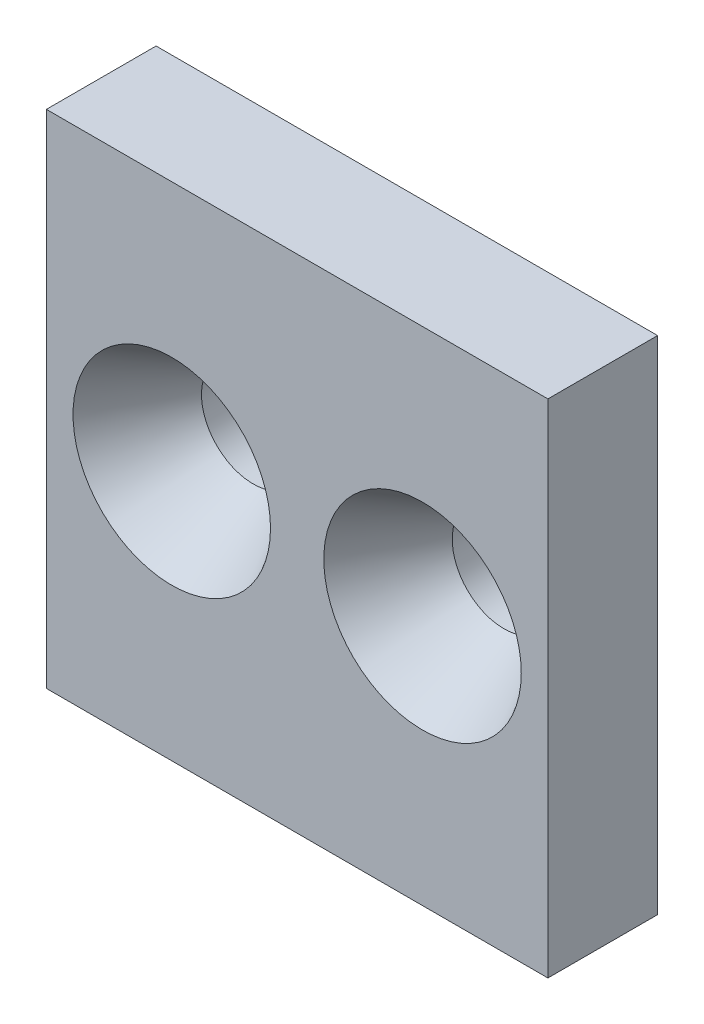
from build123d import *

# Parameters (mm, degrees)
SKETCH1_W                                      = 32
SKETCH1_H                                      = 32
EXTRUDE2_DEPTH                                 = 7
CSK_FOR_M6_FLAT_HEAD_MACHINE_SCREW1_AT_2_COUNT = 2
CSK_FOR_M6_FLAT_HEAD_MACHINE_SCREW1_AT_2_PITCH = 16


with BuildPart() as part:
    # Sketch1 → Extrude2 (new body)
    with BuildSketch(Plane.XY):
        with Locations((16, 16)):
            Rectangle(SKETCH1_W, SKETCH1_H)
    extrude(amount=EXTRUDE2_DEPTH)

    # Sketch2 → CSK for M6 Flat Head Machine Screw1 (revolve, cut)
    with BuildSketch(Plane(origin=(8, 16, 7), x_dir=(0, -1, 0), z_dir=(1, 0, 0))):
        Polygon((0, 0), (0, 7), (3.3, 7), (3.3, 5.196152423), (6.3, 0), align=None)
    csk_for_m6_flat_head_machine_screw1 = revolve(axis=Axis((8, 16, 13.35), (0, 0, -1)), mode=Mode.SUBTRACT)

    # CSK for M6 Flat Head Machine Screw1 at 2: CSK for M6 Flat Head Machine Screw1 ×2
    with Locations(*[(i * CSK_FOR_M6_FLAT_HEAD_MACHINE_SCREW1_AT_2_PITCH, 0, 0) for i in range(1, CSK_FOR_M6_FLAT_HEAD_MACHINE_SCREW1_AT_2_COUNT)]):
        add(csk_for_m6_flat_head_machine_screw1, mode=Mode.SUBTRACT)


solid = part.part
